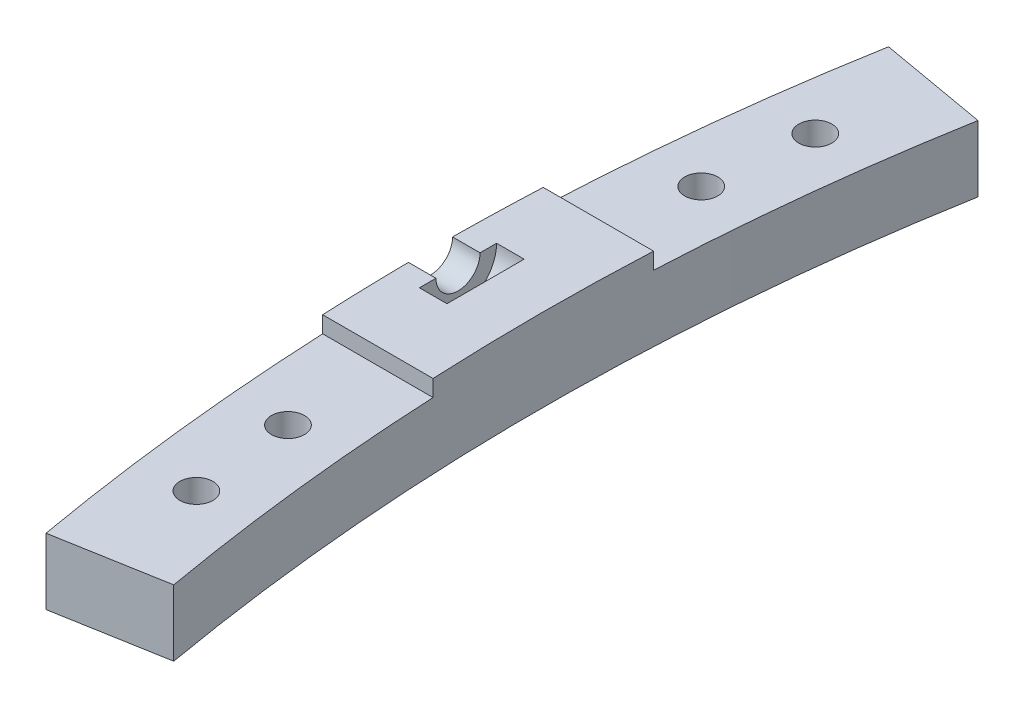
from build123d import *

# Parameters (mm, degrees)
BASE2_DEPTH            = 7.5
MOUNT2_START           = -1.5
MOUNT2_DEPTH           = 3
MOUNT_HOLE2_DEPTH      = 224.418192135
MOUNT_HOLE2_DEPTH_BACK = 224.418192135
SKETCH16_R             = 1.5
SKETCH18_W             = 2.5
SKETCH18_H             = 3.5
SKETCH19_R             = 2
SHAFTHOLE_DEPTH        = 40.784051683
SKETCH20_W             = 20
SKETCH20_H             = 76.405198174
CUT_EXTRUDE10_DEPTH    = 10


with BuildPart() as part:
    # Sketch13 → base2 (new, symmetric)
    with BuildSketch(Plane(origin=(0, 0, 0), x_dir=(1, 0, 0), z_dir=(0, 1, 0))):
        with BuildLine():
            ThreePointArc((-209.761769634, 10), (-208.70564487, 23.279901188), (-206.809628133, 36.46611731))
            Line((-206.809628133, 36.46611731), (-216.657705663, 38.202599087))
            ThreePointArc((-216.657705663, 38.202599087), (-218.670303662, 24.151569236), (-219.772609758, 10))
            Line((-219.772609758, 10), (-209.761769634, 10))
        make_face()
        with BuildLine():
            ThreePointArc((-209.761769634, -10), (-210, 0), (-209.761769634, 10))
            Line((-209.761769634, 10), (-219.772609758, 10))
            ThreePointArc((-219.772609758, 10), (-220, 0), (-219.772609758, -10))
            Line((-219.772609758, -10), (-209.761769634, -10))
        make_face()
        with BuildLine():
            Line((-216.657705663, -38.202599087), (-206.809628133, -36.46611731))
            ThreePointArc((-206.809628133, -36.46611731), (-208.70564487, -23.279901188), (-209.761769634, -10))
            Line((-209.761769634, -10), (-219.772609758, -10))
            ThreePointArc((-219.772609758, -10), (-218.670303662, -24.151569236), (-216.657705663, -38.202599087))
        make_face()
    extrude(amount=BASE2_DEPTH, both=True)

    # Sketch14 → mount2 (cut)
    with BuildSketch(Plane(origin=(0, 0, 0), x_dir=(1, 0, 0), z_dir=(0, 1, 0)).offset(MOUNT2_START)):
        with BuildLine():
            Line((-209.761769634, -10), (-219.772609758, -10))
            ThreePointArc((-219.772609758, -10), (-218.670303662, -24.151569236), (-216.657705663, -38.202599087))
            Line((-216.657705663, -38.202599087), (-206.809628133, -36.46611731))
            ThreePointArc((-206.809628133, -36.46611731), (-208.70564487, -23.279901188), (-209.761769634, -10))
        make_face()
        with BuildLine():
            Line((-209.761769634, 10), (-219.772609758, 10))
            ThreePointArc((-219.772609758, 10), (-218.670303662, 24.151569236), (-216.657705663, 38.202599087))
            Line((-216.657705663, 38.202599087), (-206.809628133, 36.46611731))
            ThreePointArc((-206.809628133, 36.46611731), (-208.70564487, 23.279901188), (-209.761769634, 10))
        make_face()
    extrude(amount=MOUNT2_DEPTH, mode=Mode.SUBTRACT)

    # Sketch16 → mount hole2 (cut, two sides: drawn at the far end of the back side and taken through both)
    with BuildSketch(Plane(origin=(0, 0, 0), x_dir=(1, 0, 0), z_dir=(0, 1, 0)).offset(-MOUNT_HOLE2_DEPTH_BACK)):
        with Locations(Location((-213.160645195, 28.063131327, 0), (0, 0, 270))):
            Circle(SKETCH16_R)
        with Locations(Location((-214.18186009, 18.738484691, 0), (0, 0, 270))):
            Circle(SKETCH16_R)
        with Locations(Location((-214.18186009, -18.738484691, 0), (0, 0, 270))):
            Circle(SKETCH16_R)
        with Locations(Location((-213.160645195, -28.063131327, 0), (0, 0, 270))):
            Circle(SKETCH16_R)
    extrude(amount=MOUNT_HOLE2_DEPTH + MOUNT_HOLE2_DEPTH_BACK, mode=Mode.SUBTRACT)

    # Sketch18 → bearing (revolve, cut)
    with BuildSketch(Plane(origin=(0, 0, 0), x_dir=(1, 0, 0), z_dir=(0, 1, 0)), mode=Mode.PRIVATE) as bearing_sk:
        with Locations((-216.25, 1.75)):
            Rectangle(SKETCH18_W, SKETCH18_H)
    revolve(bearing_sk.sketch.rotate(Axis((-215, 0, 0), (-1, 0, 0)), 180), axis=Axis((-215, 0, 0), (-1, 0, 0)), mode=Mode.SUBTRACT)

    # Sketch19 → shafthole (cut, through all)
    with BuildSketch(Plane(origin=(-215, 0, 0), x_dir=(0, 0, -1), z_dir=(1, 0, 0))):
        Circle(SKETCH19_R)
    extrude(amount=-SHAFTHOLE_DEPTH, mode=Mode.SUBTRACT)

    # Sketch20 → Cut-Extrude10 (cut)
    with BuildSketch(Plane(origin=(0, 0, 0), x_dir=(1, 0, 0), z_dir=(0, 1, 0))):
        with Locations((-210, 0)):
            Rectangle(SKETCH20_W, SKETCH20_H)
    extrude(amount=CUT_EXTRUDE10_DEPTH, mode=Mode.SUBTRACT)


solid = part.part
